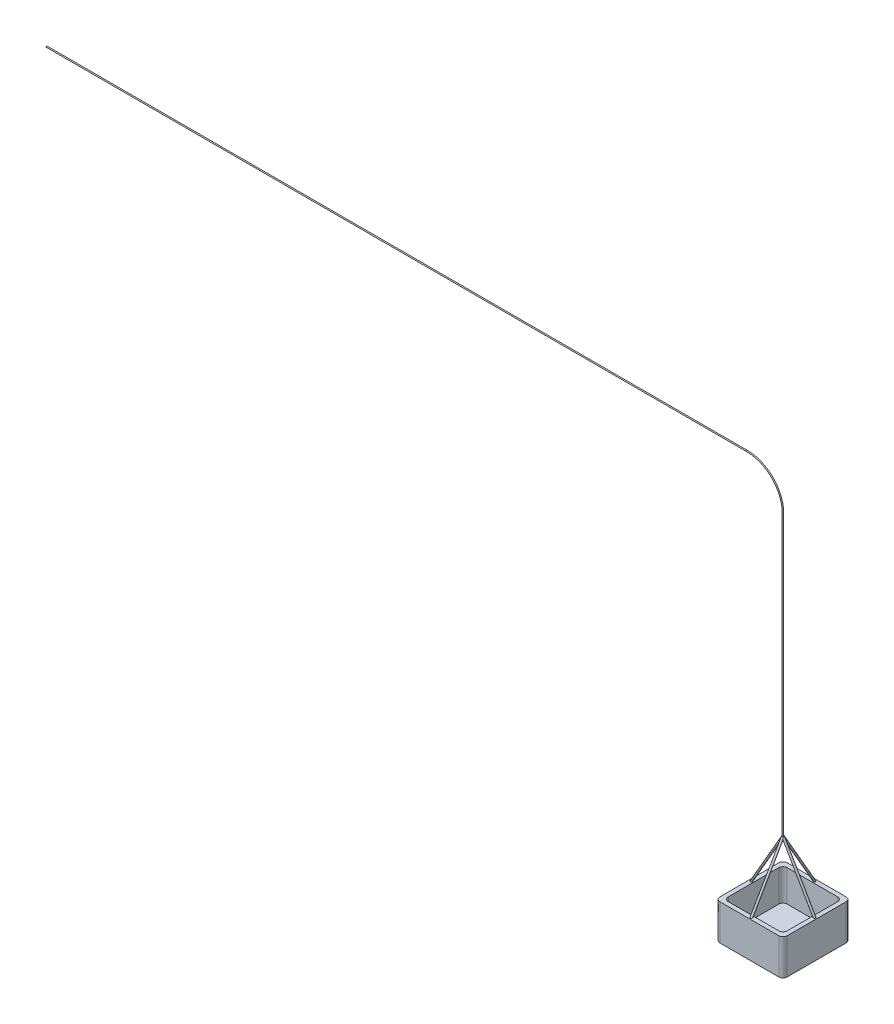
from build123d import *

# Parameters (mm, degrees)
SKETCH2_R           = 0.25
SKETCH4_R           = 0.5
CIRPATTERN1_COUNT   = 4
SKETCH5_W           = 32
SKETCH5_H           = 32
SKETCH5_W_2         = 28
SKETCH5_H_2         = 28
BOSS_EXTRUDE1_DEPTH = 15
SKETCH6_W           = 32
SKETCH6_H           = 32
BOSS_EXTRUDE2_DEPTH = 2
FILLET1_R           = 2


with BuildPart() as part:
    # Sweep1: sweep along a path in Sketch1
    with BuildLine(Plane.XY) as sweep1_path:
        Line((0, 0), (332.92, 0))
        ThreePointArc((332.92, 0), (344.997383823, -5.002616177), (350, -17.08))
        Line((350, -17.08), (350, -150))
    # Sketch2 → Sweep1 (sweep)
    with BuildSketch(Plane(origin=(0, 0, 0), x_dir=(0, 0, -1), z_dir=(1, 0, 0))):
        Circle(SKETCH2_R)
    sweep(path=sweep1_path.line)

    # Sweep2: sweep along a path in Sketch3
    with BuildLine(Plane(origin=(0, 0, 0), x_dir=(0, -1, 0), z_dir=(0, 0, 1))) as sweep2_path:
        Line((150, 350), (175.980762114, 365))
    # Sketch4 → Sweep2 (sweep)
    with BuildSketch(Plane(origin=(0, -175.980762114, 0), x_dir=(1, 0, 0), z_dir=(0, 1, 0))):
        with Locations((365, 0)):
            Circle(SKETCH4_R)
    sweep2 = sweep(path=sweep2_path.line)

    # CirPattern1: Sweep2 ×4 about axis
    cirpattern1_axis = Axis((350, -17.08, 0), (0, -1, 0))
    for i in range(1, CIRPATTERN1_COUNT):
        add(sweep2.rotate(cirpattern1_axis, i * 360 / CIRPATTERN1_COUNT))

    # Sketch5 → Boss-Extrude1 (add)
    with BuildSketch(Plane.XZ.offset(175.980762114)):
        with Locations((350, 0)):
            Rectangle(SKETCH5_W, SKETCH5_H)
        with Locations((350, 0)):
            Rectangle(SKETCH5_W_2, SKETCH5_H_2, mode=Mode.SUBTRACT)
    extrude(amount=BOSS_EXTRUDE1_DEPTH)

    # Sketch6 → Boss-Extrude2 (add)
    with BuildSketch(Plane.XZ.offset(190.980762114)):
        with Locations((350, 0)):
            Rectangle(SKETCH6_W, SKETCH6_H)
    extrude(amount=BOSS_EXTRUDE2_DEPTH)

    # Fillet1
    fillet1_edges = [part.edges().sort_by_distance(p)[0] for p in [
        (366, -184.480762114, 16),
        (336, -183.480762114, 14),
        (336, -183.480762114, -14),
        (364, -183.480762114, -14),
        (334, -184.480762114, 16),
        (366, -184.480762114, -16),
        (364, -183.480762114, 14),
        (334, -184.480762114, -16),
    ]]
    fillet(fillet1_edges, radius=FILLET1_R)


solid = part.part
